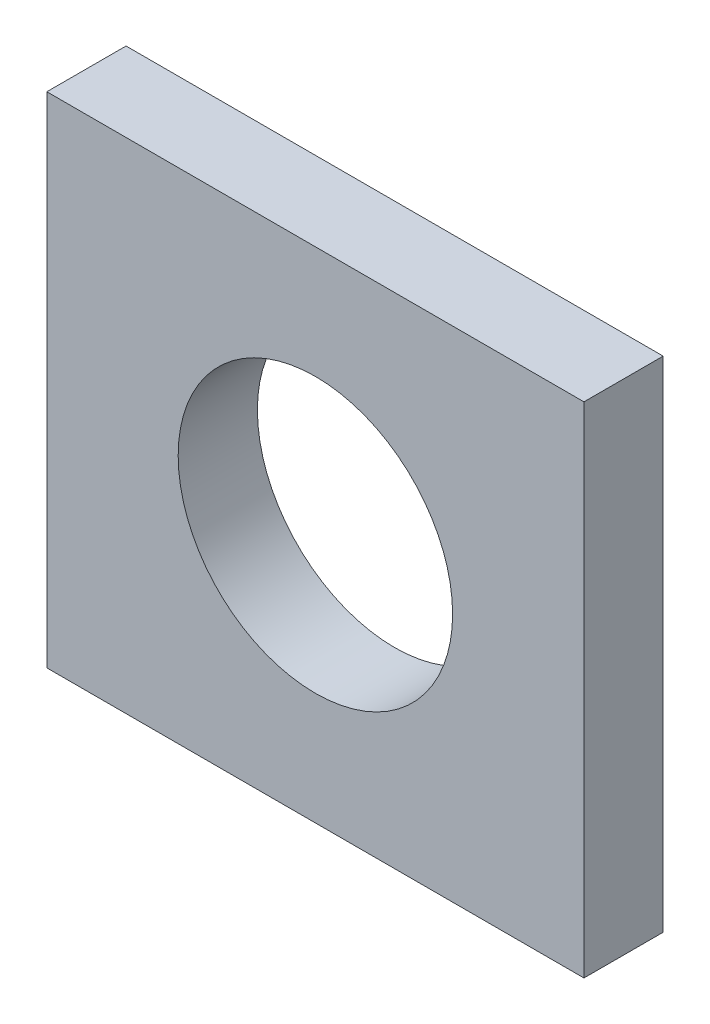
from build123d import *

# Parameters (mm, degrees)
SKETCH1_W           = 43.056347335
SKETCH1_H           = 40
BOSS_EXTRUDE1_DEPTH = 6.35
SKETCH2_R           = 11
CUT_EXTRUDE1_DEPTH  = 10


with BuildPart() as part:
    # Sketch1 → Boss-Extrude1 (new body)
    with BuildSketch(Plane.XY):
        with Locations((-21.528173668, 20)):
            Rectangle(SKETCH1_W, SKETCH1_H)
    extrude(amount=BOSS_EXTRUDE1_DEPTH)

    # Sketch2 → Cut-Extrude1 (cut)
    with BuildSketch(Plane.XY.offset(6.35)):
        with Locations((-21.528173667, 20)):
            Circle(SKETCH2_R)
    extrude(amount=-CUT_EXTRUDE1_DEPTH, mode=Mode.SUBTRACT)


solid = part.part
